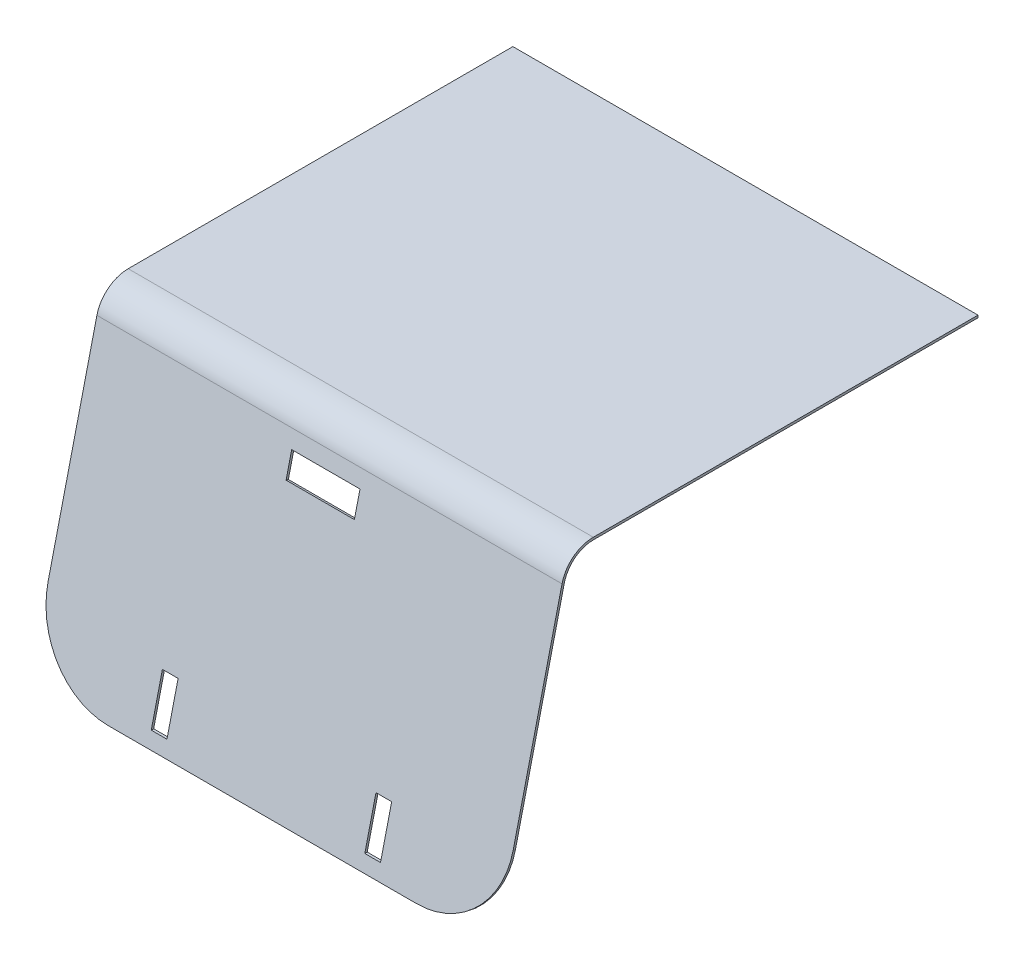
from build123d import *

# Parameters (mm, degrees)
EXTRUDE_1_DEPTH      = 296.2
EXTRUDE_1_DEPTH_BACK = 296.2
CUT_EXTRUDE_1_REACH  = 765.895
SKETCH_3_W           = 20
SKETCH_3_H           = 60
FILLET_1_R           = 100
CUT_EXTRUDE_2_REACH  = 698.157
SKETCH_10_W          = 87
SKETCH_10_H          = 31
SKETCH_11_W          = 20
SKETCH_11_H          = 3
EXTRUDE_2_DEPTH      = 13
SKETCH_12_W          = 20
SKETCH_12_H          = 3
EXTRUDE_3_DEPTH      = 9


with BuildPart() as part:
    # 스케치2 → 보스-돌출1 (new, two sides: drawn at the far end of the back side and taken through both)
    with BuildSketch(Plane(origin=(0, 0, 0), x_dir=(0, 0, -1), z_dir=(1, 0, 0)).offset(-EXTRUDE_1_DEPTH_BACK)):
        with BuildLine():
            Line((-370.190899695, -67.146362149), (-367.271624482, -67.837616249))
            Line((-367.271624482, -67.837616249), (-281.999102626, 292.28170763))
            ThreePointArc((-281.999102626, 292.28170763), (-268.617139918, 313.294251439), (-245.086561619, 321.474459758))
            Line((-245.086561619, 321.474459758), (244.913438381, 321.474459758))
            Line((244.913438381, 321.474459758), (244.913438381, 324.474459758))
            Line((244.913438381, 324.474459758), (-245.086561619, 324.474459758))
            ThreePointArc((-245.086561619, 324.474459758), (-270.478085605, 315.647309269), (-284.918377839, 292.972961731))
            Line((-284.918377839, 292.972961731), (-370.190899695, -67.146362149))
        make_face()
    extrude(amount=EXTRUDE_1_DEPTH + EXTRUDE_1_DEPTH_BACK)

    # 스케치3 → 컷-돌출1 (cut, up to next)
    with BuildSketch(Plane.XY.offset(380), mode=Mode.PRIVATE) as cut_extrude_1_sk1:
        with Locations((-136, -19.036362149)):
            Rectangle(SKETCH_3_W, SKETCH_3_H)
    cut_extrude_1_tool1 = extrude(cut_extrude_1_sk1.sketch, amount=-CUT_EXTRUDE_1_REACH, mode=Mode.PRIVATE) & part.part
    # 스케치3 → 컷-돌출1 (cut, up to next)
    with BuildSketch(Plane.XY.offset(380), mode=Mode.PRIVATE) as cut_extrude_1_sk2:
        with Locations((136, -19.036362149)):
            Rectangle(SKETCH_3_W, SKETCH_3_H)
    cut_extrude_1_tool2 = extrude(cut_extrude_1_sk2.sketch, amount=-CUT_EXTRUDE_1_REACH, mode=Mode.PRIVATE) & part.part
    add(cut_extrude_1_tool1.solids().sort_by_distance((-136, -19.036362, 380))[0], mode=Mode.SUBTRACT)
    add(cut_extrude_1_tool2.solids().sort_by_distance((136, -19.036362, 380))[0], mode=Mode.SUBTRACT)

    # 필렛1
    fillet_1_edges = [part.edges().sort_by_distance(p)[0] for p in [
        (-296.2, -67.491989199, 368.731262089),
        (296.2, -67.491989199, 368.731262089),
    ]]
    fillet(fillet_1_edges, radius=FILLET_1_R)

    # 스케치10 → 컷-돌출2 (cut, up to next)
    with BuildSketch(Plane(origin=(0, 79.438454224, 335.4811351), x_dir=(1, 0, 0), z_dir=(0, 0.23041803358111446, 0.9730917376078232)), mode=Mode.PRIVATE) as cut_extrude_2_sk1:
        with Locations((0, 183.93923605)):
            Rectangle(SKETCH_10_W, SKETCH_10_H)
    cut_extrude_2_tool1 = extrude(cut_extrude_2_sk1.sketch, amount=-CUT_EXTRUDE_2_REACH, mode=Mode.PRIVATE) & part.part
    add(cut_extrude_2_tool1.solids().sort_by_distance((0, 258.428205, 293.098218))[0], mode=Mode.SUBTRACT)

    # 스케치11 → 보스-돌출2 (add)
    with BuildSketch(Plane(origin=(0, 79.438454224, 335.4811351), x_dir=(1, 0, 0), z_dir=(0, 0.23041803358111446, 0.9730917376078232))):
        with Locations((251.9, -106.338229375)):
            Rectangle(SKETCH_11_W, SKETCH_11_H)
    extrude_2 = extrude(amount=-EXTRUDE_2_DEPTH)

    # 스케치12 → 보스-돌출3 (add)
    with BuildSketch(Plane(origin=(0, -102.01721479, 24.156618657), x_dir=(1, 0, 0), z_dir=(0, 0.9730917376078232, -0.23041803358111443))):
        with Locations((251.9, -333.257973102)):
            Rectangle(SKETCH_12_W, SKETCH_12_H)
    extrude_3 = extrude(amount=EXTRUDE_3_DEPTH)

    # 대칭 복사1: 보스-돌출2, 보스-돌출3 across plane
    add(extrude_2.mirror(Plane(origin=(0, 0, 0), x_dir=(0, 0, 1), z_dir=(1, 0, 0))))
    add(extrude_3.mirror(Plane(origin=(0, 0, 0), x_dir=(0, 0, 1), z_dir=(1, 0, 0))))


solid = part.part
